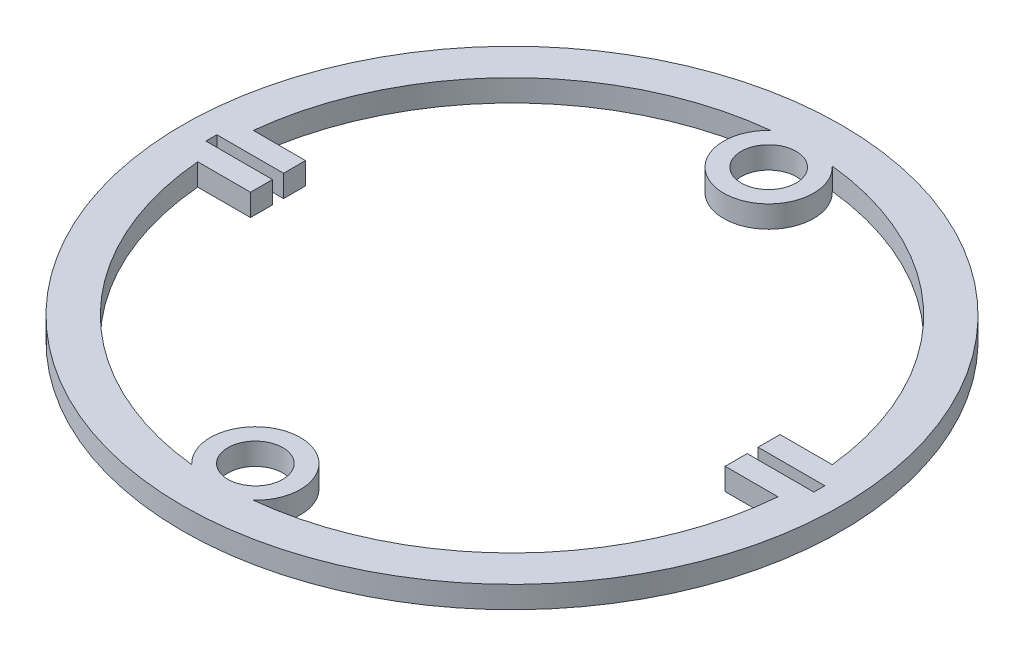
from build123d import *

# Parameters (mm, degrees)
SKETCH1_R           = 38.1
BOSS_EXTRUDE1_DEPTH = 50.8
SKETCH4_R           = 38.1
BOSS_EXTRUDE2_DEPTH = 50.8
SKETCH5_R           = 5.207
SKETCH5_R_2         = 3.175
BOSS_EXTRUDE3_DEPTH = 101.6
CUT_EXTRUDE1_START  = -99.06
SKETCH7_R           = 38.1
CUT_EXTRUDE1_DEPTH  = 99.06


with BuildPart() as part:
    # Sketch1 → Boss-Extrude1 (new body)
    with BuildSketch(Plane(origin=(0, 0, 0), x_dir=(1, 0, 0), z_dir=(0, 1, 0))):
        with Locations(Location((0, 0, 0), (0, 0, 270))):
            Circle(SKETCH1_R)
        with BuildLine():
            Line((-35.143970714, 1.018475327), (-35.143970714, -0.251524673))
            Line((-35.143970714, -0.251524673), (-27.437089542, -0.251524673))
            Line((-27.437089542, -0.251524673), (-27.437089542, -2.791524673))
            Line((-27.437089542, -2.791524673), (-33.539028236, -2.791524673))
            ThreePointArc((-33.539028236, -2.791524673), (0, -33.655), (33.539028236, -2.791524673))
            Line((33.539028236, -2.791524673), (27.437089542, -2.791524673))
            Line((27.437089542, -2.791524673), (27.437089542, -0.251524673))
            Line((27.437089542, -0.251524673), (35.143970714, -0.251524673))
            Line((35.143970714, -0.251524673), (35.143970714, 1.018475327))
            Line((35.143970714, 1.018475327), (27.42889968, 1.018475327))
            Line((27.42889968, 1.018475327), (27.42889968, 3.558475327))
            Line((27.42889968, 3.558475327), (33.466345458, 3.558475327))
            ThreePointArc((33.466345458, 3.558475327), (0, 33.655), (-33.466345458, 3.558475327))
            Line((-33.466345458, 3.558475327), (-27.42889968, 3.558475327))
            Line((-27.42889968, 3.558475327), (-27.42889968, 1.018475327))
            Line((-27.42889968, 1.018475327), (-35.143970714, 1.018475327))
        make_face(mode=Mode.SUBTRACT)
    extrude(amount=BOSS_EXTRUDE1_DEPTH)

    # Sketch4 → Boss-Extrude2 (add)
    with BuildSketch(Plane(origin=(0, 50.8, 0), x_dir=(1, 0, 0), z_dir=(0, 1, 0))):
        with Locations(Location((0, 0, 0), (0, 0, 270))):
            Circle(SKETCH4_R)
        with BuildLine():
            Line((33.466345458, 3.558475327), (-33.466345458, 3.558475327))
            ThreePointArc((-33.466345458, 3.558475327), (0, 33.655), (33.466345458, 3.558475327))
        make_face(mode=Mode.SUBTRACT)
        with BuildLine():
            Line((-27.42889968, 1.018475327), (27.42889968, 1.018475327))
            Line((27.42889968, 1.018475327), (27.432994611, 0.383475327))
            Line((27.432994611, 0.383475327), (33.652815212, 0.383475327))
            ThreePointArc((33.652815212, 0.383475327), (0, -33.655), (-33.652815212, 0.383475327))
            Line((-33.652815212, 0.383475327), (-27.432994611, 0.383475327))
            Line((-27.432994611, 0.383475327), (-27.42889968, 1.018475327))
        make_face(mode=Mode.SUBTRACT)
    extrude(amount=BOSS_EXTRUDE2_DEPTH)

    # Sketch5 → Boss-Extrude3 (add)
    # profile 1 of 2: a face of its own
    with BuildSketch(Plane.XZ):
        with Locations((0, -29.670562634)):
            Circle(SKETCH5_R)
        with Locations(Location((0, -29.670562634, 0), (0, 0, 270))):
            Circle(SKETCH5_R_2, mode=Mode.SUBTRACT)
    # profile 2 of 2: a face of its own
    with BuildSketch(Plane.XZ):
        with Locations((0, 29.670562634)):
            Circle(SKETCH5_R)
        with Locations(Location((0, 29.670562634, 0), (0, 0, 90))):
            Circle(SKETCH5_R_2, mode=Mode.SUBTRACT)
    extrude(amount=-BOSS_EXTRUDE3_DEPTH)

    # Sketch7 → Cut-Extrude1 (cut)
    with BuildSketch(Plane(origin=(0, 101.6, 0), x_dir=(1, 0, 0), z_dir=(0, 1, 0)).offset(CUT_EXTRUDE1_START)):
        with Locations(Location((0, 0, 0), (0, 0, 270))):
            Circle(SKETCH7_R)
    extrude(amount=CUT_EXTRUDE1_DEPTH, mode=Mode.SUBTRACT)


solid = part.part
